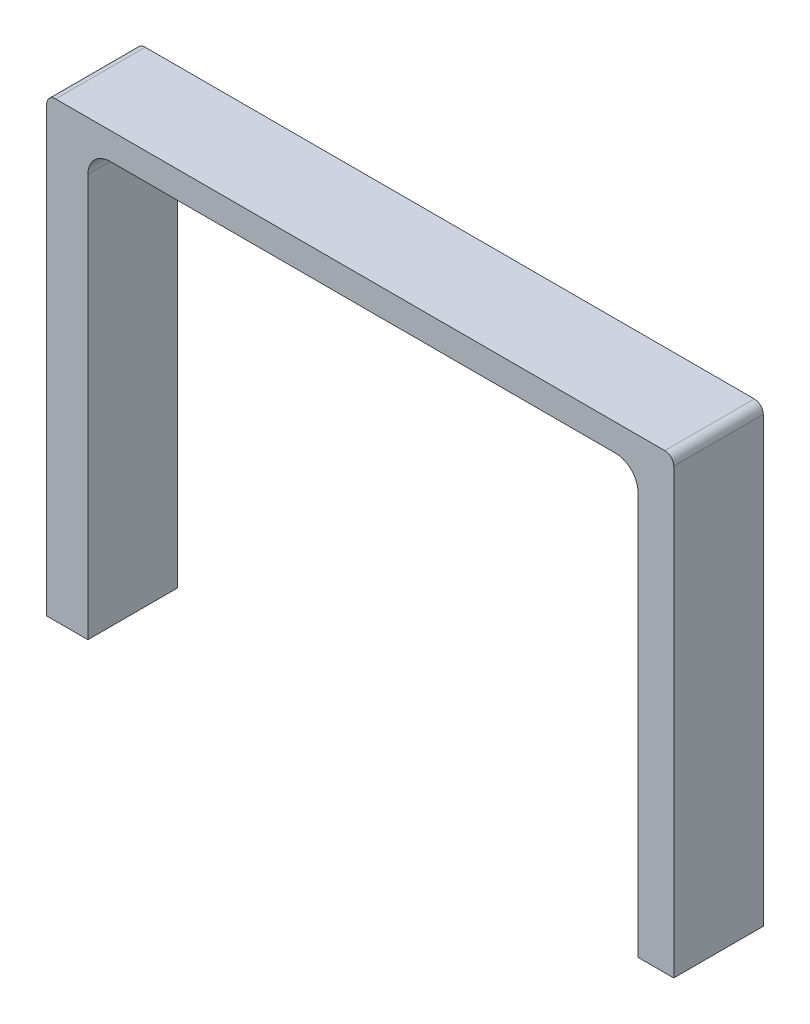
from build123d import *

# Parameters (mm, degrees)
BOSS_EXTRUDE1_DEPTH = 25.4
FILLET1_R           = 6.35
FILLET2_R           = 2.54


with BuildPart() as part:
    # Sketch1 → Boss-Extrude1 (new body)
    with BuildSketch(Plane.XY):
        Polygon((78.7654, -64.135), (88.9254, -64.135), (88.9254, 64.135), (-88.9254, 64.135), (-88.9254, -64.135), (-77.2414, -64.135), (-77.2414, 56.515), (78.7654, 56.515), align=None)
    extrude(amount=BOSS_EXTRUDE1_DEPTH)

    # Fillet1
    fillet1_edges = [part.edges().sort_by_distance(p)[0] for p in [
        (78.7654, 56.515, 12.7),
        (-77.2414, 56.515, 12.7),
    ]]
    fillet(fillet1_edges, radius=FILLET1_R)

    # Fillet2
    fillet2_edges = [part.edges().sort_by_distance(p)[0] for p in [
        (-88.9254, 64.135, 12.7),
        (88.9254, 64.135, 12.7),
    ]]
    fillet(fillet2_edges, radius=FILLET2_R)


solid = part.part
